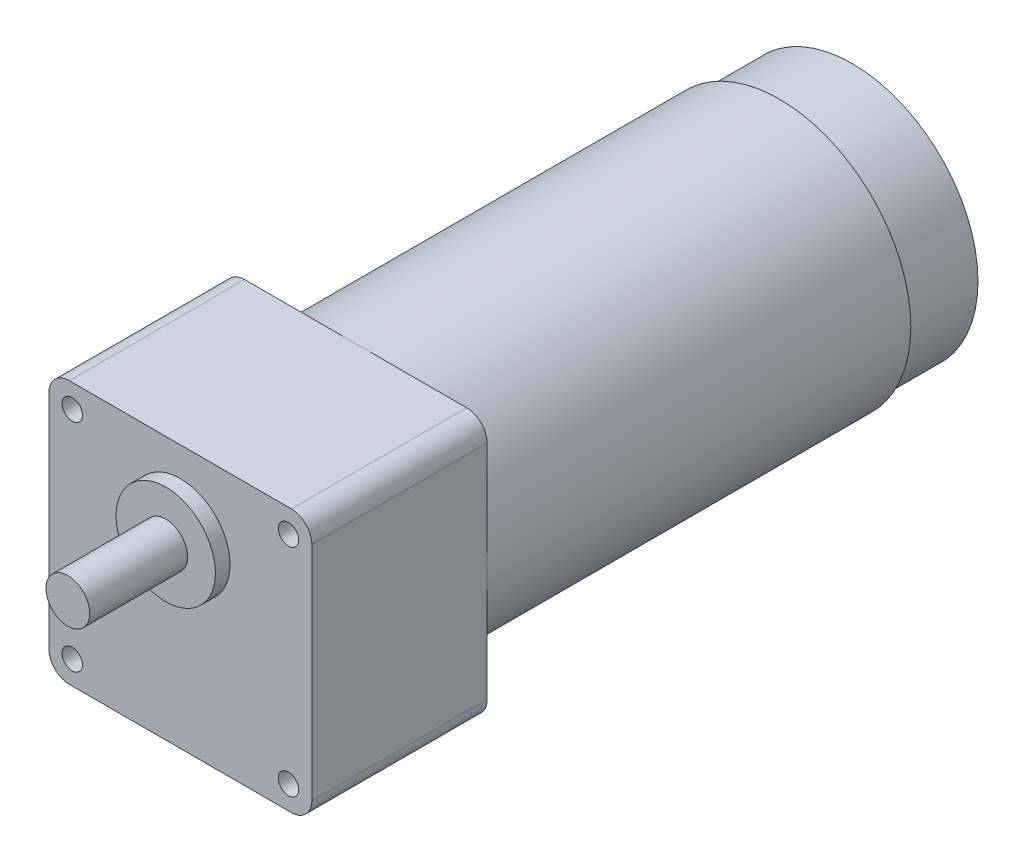
from build123d import *

# Parameters (mm, degrees)
SKETCH1_W           = 90
SKETCH1_H           = 90
BOSS_EXTRUDE1_DEPTH = 60
SKETCH2_R           = 45
BOSS_EXTRUDE2_DEPTH = 170
SKETCH3_R           = 17
BOSS_EXTRUDE3_DEPTH = 5
SKETCH4_R           = 7.5
BOSS_EXTRUDE4_DEPTH = 33.5
CUT_EXTRUDE1_REACH  = 240.642
SKETCH5_R           = 3.5
FILLET1_R           = 7
CUT_EXTRUDE2_START  = -25
SKETCH6_R           = 45
SKETCH6_R_2         = 43
CUT_EXTRUDE2_DEPTH  = 25


with BuildPart() as part:
    # Sketch1 → Boss-Extrude1 (new body)
    with BuildSketch(Plane.XY):
        Rectangle(SKETCH1_W, SKETCH1_H)
    extrude(amount=BOSS_EXTRUDE1_DEPTH)

    # Sketch2 → Boss-Extrude2 (add)
    with BuildSketch(Plane(origin=(0, 0, 0), x_dir=(-1, 0, 0), z_dir=(0, 0, -1))):
        Circle(SKETCH2_R)
    extrude(amount=BOSS_EXTRUDE2_DEPTH)

    # Sketch3 → Boss-Extrude3 (add)
    with BuildSketch(Plane.XY.offset(60)):
        with Locations((0, 18)):
            Circle(SKETCH3_R)
    extrude(amount=BOSS_EXTRUDE3_DEPTH)

    # Sketch4 → Boss-Extrude4 (add)
    with BuildSketch(Plane.XY.offset(65)):
        with Locations((0, 18)):
            Circle(SKETCH4_R)
    extrude(amount=BOSS_EXTRUDE4_DEPTH)

    # Sketch5 → Cut-Extrude1 (cut, up to next)
    with BuildSketch(Plane.XY.offset(60), mode=Mode.PRIVATE) as cut_extrude1_sk1:
        with Locations((-37, 37)):
            Circle(SKETCH5_R)
    cut_extrude1_tool1 = extrude(cut_extrude1_sk1.sketch, amount=-CUT_EXTRUDE1_REACH, mode=Mode.PRIVATE) & part.part
    # Sketch5 → Cut-Extrude1 (cut, up to next)
    with BuildSketch(Plane.XY.offset(60), mode=Mode.PRIVATE) as cut_extrude1_sk2:
        with Locations((37, 37)):
            Circle(SKETCH5_R)
    cut_extrude1_tool2 = extrude(cut_extrude1_sk2.sketch, amount=-CUT_EXTRUDE1_REACH, mode=Mode.PRIVATE) & part.part
    # Sketch5 → Cut-Extrude1 (cut, up to next)
    with BuildSketch(Plane.XY.offset(60), mode=Mode.PRIVATE) as cut_extrude1_sk3:
        with Locations((37, -37)):
            Circle(SKETCH5_R)
    cut_extrude1_tool3 = extrude(cut_extrude1_sk3.sketch, amount=-CUT_EXTRUDE1_REACH, mode=Mode.PRIVATE) & part.part
    # Sketch5 → Cut-Extrude1 (cut, up to next)
    with BuildSketch(Plane.XY.offset(60), mode=Mode.PRIVATE) as cut_extrude1_sk4:
        with Locations((-37, -37)):
            Circle(SKETCH5_R)
    cut_extrude1_tool4 = extrude(cut_extrude1_sk4.sketch, amount=-CUT_EXTRUDE1_REACH, mode=Mode.PRIVATE) & part.part
    add(cut_extrude1_tool1.solids().sort_by_distance((-37, 37, 60))[0], mode=Mode.SUBTRACT)
    add(cut_extrude1_tool2.solids().sort_by_distance((37, 37, 60))[0], mode=Mode.SUBTRACT)
    add(cut_extrude1_tool3.solids().sort_by_distance((37, -37, 60))[0], mode=Mode.SUBTRACT)
    add(cut_extrude1_tool4.solids().sort_by_distance((-37, -37, 60))[0], mode=Mode.SUBTRACT)

    # Fillet1
    fillet1_edges = [part.edges().sort_by_distance(p)[0] for p in [
        (45, -45, 30),
        (-45, -45, 30),
        (-45, 45, 30),
        (45, 45, 30),
    ]]
    fillet(fillet1_edges, radius=FILLET1_R)

    # Sketch6 → Cut-Extrude2 (cut)
    with BuildSketch(Plane(origin=(0, 0, -170), x_dir=(-1, 0, 0), z_dir=(0, 0, -1)).offset(CUT_EXTRUDE2_START)):
        Circle(SKETCH6_R)
        Circle(SKETCH6_R_2, mode=Mode.SUBTRACT)
    extrude(amount=CUT_EXTRUDE2_DEPTH, mode=Mode.SUBTRACT)


solid = part.part
